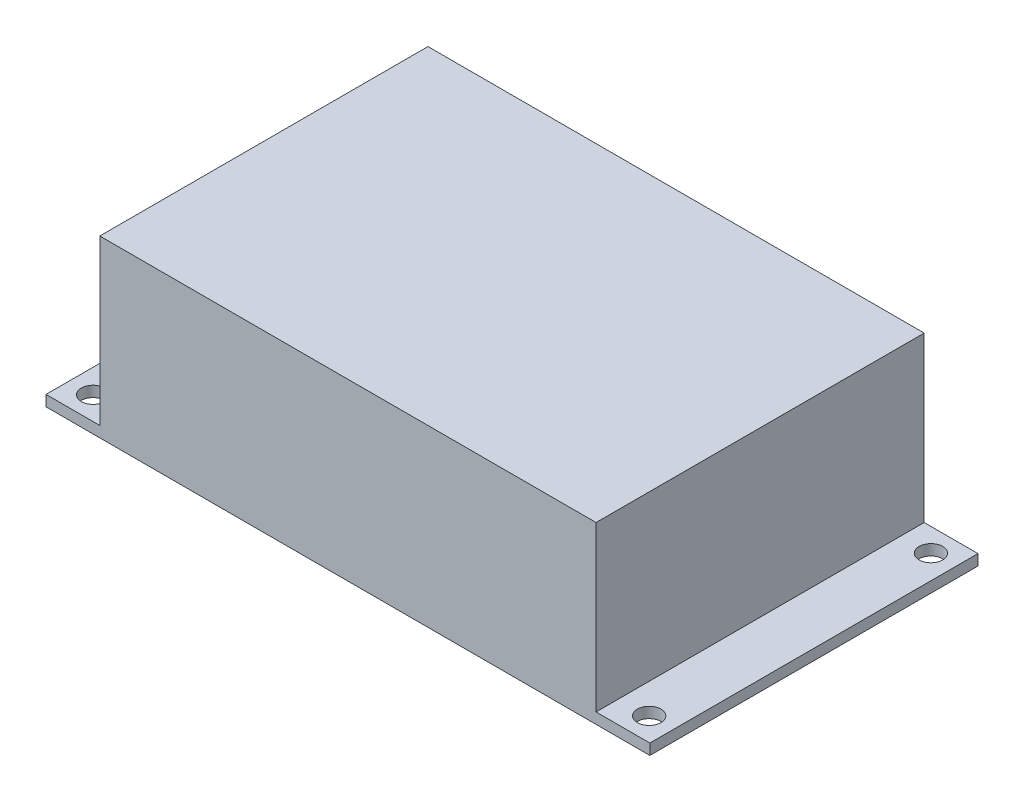
from build123d import *

# Parameters (mm, degrees)
SKETCH_1_W          = 89.8
SKETCH_1_H          = 48.8
EXTRUDE_1_DEPTH     = 1.6
SKETCH_2_R          = 1.75
CUT_EXTRUDE_1_DEPTH = 1.6
SKETCH_3_W          = 73.8
SKETCH_3_H          = 48.8
EXTRUDE_2_DEPTH     = 24.4


with BuildPart() as part:
    # 草图1 → 凸台-拉伸1 (new body)
    with BuildSketch(Plane(origin=(0, 0, 0), x_dir=(1, 0, 0), z_dir=(0, 1, 0))):
        Rectangle(SKETCH_1_W, SKETCH_1_H)
    extrude(amount=EXTRUDE_1_DEPTH)

    # 草图2 → 切除-拉伸1 (cut)
    with BuildSketch(Plane(origin=(0, 1.6, 0), x_dir=(1, 0, 0), z_dir=(0, 1, 0))):
        with Locations(Location((-41.35, 20.95, 0), (0, 0, 270))):
            Circle(SKETCH_2_R)
        with Locations(Location((-41.35, -20.95, 0), (0, 0, 90))):
            Circle(SKETCH_2_R)
        with Locations(Location((41.35, -20.95, 0), (0, 0, 270))):
            Circle(SKETCH_2_R)
        with Locations(Location((41.35, 20.95, 0), (0, 0, 90))):
            Circle(SKETCH_2_R)
    extrude(amount=-CUT_EXTRUDE_1_DEPTH, mode=Mode.SUBTRACT)

    # 草图3 → 凸台-拉伸2 (add)
    with BuildSketch(Plane(origin=(0, 1.6, 0), x_dir=(1, 0, 0), z_dir=(0, 1, 0))):
        Rectangle(SKETCH_3_W, SKETCH_3_H)
    extrude(amount=EXTRUDE_2_DEPTH)


solid = part.part
